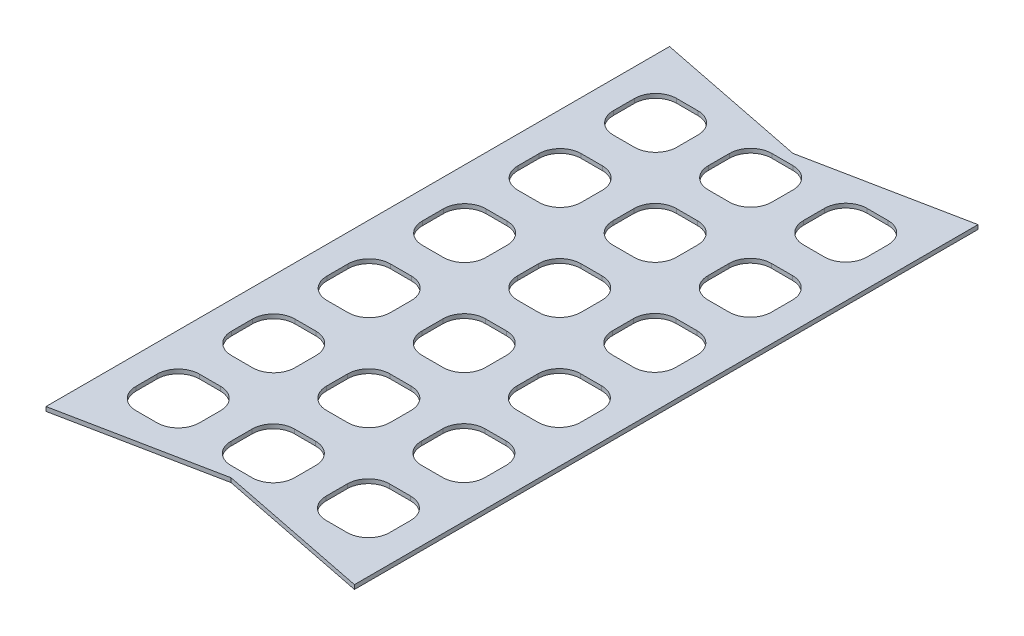
from build123d import *

# Parameters (mm, degrees)
BOSS_EXTRUDE1_DEPTH = 2
CUT_EXTRUDE1_DEPTH  = 165.642246537


with BuildPart() as part:
    # Sketch1 → Boss-Extrude1 (new body)
    with BuildSketch(Plane(origin=(0, 0, 0), x_dir=(1, 0, 0), z_dir=(0, 1, 0))):
        Polygon((-73, 147.560392195), (-73, -147.560392195), (0, -132.960392195), (73, -147.560392195), (73, 147.560392195), (0, 132.960392195), align=None)
    extrude(amount=BOSS_EXTRUDE1_DEPTH)

    # Sketch2 → Cut-Extrude1 (cut, through all)
    with BuildSketch(Plane(origin=(0, 2, 0), x_dir=(1, 0, 0), z_dir=(0, 1, 0))):
        with BuildLine():
            Line((-50, -127.960392195), (-40, -127.960392195))
            ThreePointArc((-40, -127.960392195), (-32.928932188, -125.031460006), (-30, -117.960392195))
            Line((-30, -117.960392195), (-30, -107.960392195))
            ThreePointArc((-30, -107.960392195), (-32.928932188, -100.889324383), (-40, -97.960392195))
            Line((-40, -97.960392195), (-50, -97.960392195))
            ThreePointArc((-50, -97.960392195), (-57.071067812, -100.889324383), (-60, -107.960392195))
            Line((-60, -107.960392195), (-60, -117.960392195))
            ThreePointArc((-60, -117.960392195), (-57.071067812, -125.031460006), (-50, -127.960392195))
        make_face()
        with BuildLine():
            Line((-15, -117.960392195), (-15, -107.960392195))
            ThreePointArc((-15, -107.960392195), (-12.071067812, -100.889324383), (-5, -97.960392195))
            Line((-5, -97.960392195), (5, -97.960392195))
            ThreePointArc((5, -97.960392195), (12.071067812, -100.889324383), (15, -107.960392195))
            Line((15, -107.960392195), (15, -117.960392195))
            ThreePointArc((15, -117.960392195), (12.071067812, -125.031460006), (5, -127.960392195))
            Line((5, -127.960392195), (-5, -127.960392195))
            ThreePointArc((-5, -127.960392195), (-12.071067812, -125.031460006), (-15, -117.960392195))
        make_face()
        with BuildLine():
            Line((30, -117.960392195), (30, -107.960392195))
            ThreePointArc((30, -107.960392195), (32.928932188, -100.889324383), (40, -97.960392195))
            Line((40, -97.960392195), (50, -97.960392195))
            ThreePointArc((50, -97.960392195), (57.071067812, -100.889324383), (60, -107.960392195))
            Line((60, -107.960392195), (60, -117.960392195))
            ThreePointArc((60, -117.960392195), (57.071067812, -125.031460006), (50, -127.960392195))
            Line((50, -127.960392195), (40, -127.960392195))
            ThreePointArc((40, -127.960392195), (32.928932188, -125.031460006), (30, -117.960392195))
        make_face()
        with BuildLine():
            Line((-60, -72.776235317), (-60, -62.776235317))
            ThreePointArc((-60, -62.776235317), (-57.071067812, -55.705167505), (-50, -52.776235317))
            Line((-50, -52.776235317), (-40, -52.776235317))
            ThreePointArc((-40, -52.776235317), (-32.928932188, -55.705167505), (-30, -62.776235317))
            Line((-30, -62.776235317), (-30, -72.776235317))
            ThreePointArc((-30, -72.776235317), (-32.928932188, -79.847303129), (-40, -82.776235317))
            Line((-40, -82.776235317), (-50, -82.776235317))
            ThreePointArc((-50, -82.776235317), (-57.071067812, -79.847303129), (-60, -72.776235317))
        make_face()
        with BuildLine():
            Line((-15, -72.776235317), (-15, -62.776235317))
            ThreePointArc((-15, -62.776235317), (-12.071067812, -55.705167505), (-5, -52.776235317))
            Line((-5, -52.776235317), (5, -52.776235317))
            ThreePointArc((5, -52.776235317), (12.071067812, -55.705167505), (15, -62.776235317))
            Line((15, -62.776235317), (15, -72.776235317))
            ThreePointArc((15, -72.776235317), (12.071067812, -79.847303129), (5, -82.776235317))
            Line((5, -82.776235317), (-5, -82.776235317))
            ThreePointArc((-5, -82.776235317), (-12.071067812, -79.847303129), (-15, -72.776235317))
        make_face()
        with BuildLine():
            Line((30, -72.776235317), (30, -62.776235317))
            ThreePointArc((30, -62.776235317), (32.928932188, -55.705167505), (40, -52.776235317))
            Line((40, -52.776235317), (50, -52.776235317))
            ThreePointArc((50, -52.776235317), (57.071067812, -55.705167505), (60, -62.776235317))
            Line((60, -62.776235317), (60, -72.776235317))
            ThreePointArc((60, -72.776235317), (57.071067812, -79.847303129), (50, -82.776235317))
            Line((50, -82.776235317), (40, -82.776235317))
            ThreePointArc((40, -82.776235317), (32.928932188, -79.847303129), (30, -72.776235317))
        make_face()
        with BuildLine():
            Line((-60, -27.592078439), (-60, -17.592078439))
            ThreePointArc((-60, -17.592078439), (-57.071067812, -10.521010627), (-50, -7.592078439))
            Line((-50, -7.592078439), (-40, -7.592078439))
            ThreePointArc((-40, -7.592078439), (-32.928932188, -10.521010627), (-30, -17.592078439))
            Line((-30, -17.592078439), (-30, -27.592078439))
            ThreePointArc((-30, -27.592078439), (-32.928932188, -34.663146251), (-40, -37.592078439))
            Line((-40, -37.592078439), (-50, -37.592078439))
            ThreePointArc((-50, -37.592078439), (-57.071067812, -34.663146251), (-60, -27.592078439))
        make_face()
        with BuildLine():
            Line((-15, -27.592078439), (-15, -17.592078439))
            ThreePointArc((-15, -17.592078439), (-12.071067812, -10.521010627), (-5, -7.592078439))
            Line((-5, -7.592078439), (5, -7.592078439))
            ThreePointArc((5, -7.592078439), (12.071067812, -10.521010627), (15, -17.592078439))
            Line((15, -17.592078439), (15, -27.592078439))
            ThreePointArc((15, -27.592078439), (12.071067812, -34.663146251), (5, -37.592078439))
            Line((5, -37.592078439), (-5, -37.592078439))
            ThreePointArc((-5, -37.592078439), (-12.071067812, -34.663146251), (-15, -27.592078439))
        make_face()
        with BuildLine():
            Line((30, -27.592078439), (30, -17.592078439))
            ThreePointArc((30, -17.592078439), (32.928932188, -10.521010627), (40, -7.592078439))
            Line((40, -7.592078439), (50, -7.592078439))
            ThreePointArc((50, -7.592078439), (57.071067812, -10.521010627), (60, -17.592078439))
            Line((60, -17.592078439), (60, -27.592078439))
            ThreePointArc((60, -27.592078439), (57.071067812, -34.663146251), (50, -37.592078439))
            Line((50, -37.592078439), (40, -37.592078439))
            ThreePointArc((40, -37.592078439), (32.928932188, -34.663146251), (30, -27.592078439))
        make_face()
        with BuildLine():
            Line((-60, 17.592078439), (-60, 27.592078439))
            ThreePointArc((-60, 27.592078439), (-57.071067812, 34.663146251), (-50, 37.592078439))
            Line((-50, 37.592078439), (-40, 37.592078439))
            ThreePointArc((-40, 37.592078439), (-32.928932188, 34.663146251), (-30, 27.592078439))
            Line((-30, 27.592078439), (-30, 17.592078439))
            ThreePointArc((-30, 17.592078439), (-32.928932188, 10.521010627), (-40, 7.592078439))
            Line((-40, 7.592078439), (-50, 7.592078439))
            ThreePointArc((-50, 7.592078439), (-57.071067812, 10.521010627), (-60, 17.592078439))
        make_face()
        with BuildLine():
            Line((-15, 17.592078439), (-15, 27.592078439))
            ThreePointArc((-15, 27.592078439), (-12.071067812, 34.663146251), (-5, 37.592078439))
            Line((-5, 37.592078439), (5, 37.592078439))
            ThreePointArc((5, 37.592078439), (12.071067812, 34.663146251), (15, 27.592078439))
            Line((15, 27.592078439), (15, 17.592078439))
            ThreePointArc((15, 17.592078439), (12.071067812, 10.521010627), (5, 7.592078439))
            Line((5, 7.592078439), (-5, 7.592078439))
            ThreePointArc((-5, 7.592078439), (-12.071067812, 10.521010627), (-15, 17.592078439))
        make_face()
        with BuildLine():
            Line((30, 17.592078439), (30, 27.592078439))
            ThreePointArc((30, 27.592078439), (32.928932188, 34.663146251), (40, 37.592078439))
            Line((40, 37.592078439), (50, 37.592078439))
            ThreePointArc((50, 37.592078439), (57.071067812, 34.663146251), (60, 27.592078439))
            Line((60, 27.592078439), (60, 17.592078439))
            ThreePointArc((60, 17.592078439), (57.071067812, 10.521010627), (50, 7.592078439))
            Line((50, 7.592078439), (40, 7.592078439))
            ThreePointArc((40, 7.592078439), (32.928932188, 10.521010627), (30, 17.592078439))
        make_face()
        with BuildLine():
            Line((-60, 62.776235317), (-60, 72.776235317))
            ThreePointArc((-60, 72.776235317), (-57.071067812, 79.847303129), (-50, 82.776235317))
            Line((-50, 82.776235317), (-40, 82.776235317))
            ThreePointArc((-40, 82.776235317), (-32.928932188, 79.847303129), (-30, 72.776235317))
            Line((-30, 72.776235317), (-30, 62.776235317))
            ThreePointArc((-30, 62.776235317), (-32.928932188, 55.705167505), (-40, 52.776235317))
            Line((-40, 52.776235317), (-50, 52.776235317))
            ThreePointArc((-50, 52.776235317), (-57.071067812, 55.705167505), (-60, 62.776235317))
        make_face()
        with BuildLine():
            Line((-15, 62.776235317), (-15, 72.776235317))
            ThreePointArc((-15, 72.776235317), (-12.071067812, 79.847303129), (-5, 82.776235317))
            Line((-5, 82.776235317), (5, 82.776235317))
            ThreePointArc((5, 82.776235317), (12.071067812, 79.847303129), (15, 72.776235317))
            Line((15, 72.776235317), (15, 62.776235317))
            ThreePointArc((15, 62.776235317), (12.071067812, 55.705167505), (5, 52.776235317))
            Line((5, 52.776235317), (-5, 52.776235317))
            ThreePointArc((-5, 52.776235317), (-12.071067812, 55.705167505), (-15, 62.776235317))
        make_face()
        with BuildLine():
            Line((30, 62.776235317), (30, 72.776235317))
            ThreePointArc((30, 72.776235317), (32.928932188, 79.847303129), (40, 82.776235317))
            Line((40, 82.776235317), (50, 82.776235317))
            ThreePointArc((50, 82.776235317), (57.071067812, 79.847303129), (60, 72.776235317))
            Line((60, 72.776235317), (60, 62.776235317))
            ThreePointArc((60, 62.776235317), (57.071067812, 55.705167505), (50, 52.776235317))
            Line((50, 52.776235317), (40, 52.776235317))
            ThreePointArc((40, 52.776235317), (32.928932188, 55.705167505), (30, 62.776235317))
        make_face()
        with BuildLine():
            Line((-60, 107.960392195), (-60, 117.960392195))
            ThreePointArc((-60, 117.960392195), (-57.071067812, 125.031460006), (-50, 127.960392195))
            Line((-50, 127.960392195), (-40, 127.960392195))
            ThreePointArc((-40, 127.960392195), (-32.928932188, 125.031460006), (-30, 117.960392195))
            Line((-30, 117.960392195), (-30, 107.960392195))
            ThreePointArc((-30, 107.960392195), (-32.928932188, 100.889324383), (-40, 97.960392195))
            Line((-40, 97.960392195), (-50, 97.960392195))
            ThreePointArc((-50, 97.960392195), (-57.071067812, 100.889324383), (-60, 107.960392195))
        make_face()
        with BuildLine():
            Line((-15, 107.960392195), (-15, 117.960392195))
            ThreePointArc((-15, 117.960392195), (-12.071067812, 125.031460006), (-5, 127.960392195))
            Line((-5, 127.960392195), (5, 127.960392195))
            ThreePointArc((5, 127.960392195), (12.071067812, 125.031460006), (15, 117.960392195))
            Line((15, 117.960392195), (15, 107.960392195))
            ThreePointArc((15, 107.960392195), (12.071067812, 100.889324383), (5, 97.960392195))
            Line((5, 97.960392195), (-5, 97.960392195))
            ThreePointArc((-5, 97.960392195), (-12.071067812, 100.889324383), (-15, 107.960392195))
        make_face()
        with BuildLine():
            Line((30, 107.960392195), (30, 117.960392195))
            ThreePointArc((30, 117.960392195), (32.928932188, 125.031460006), (40, 127.960392195))
            Line((40, 127.960392195), (50, 127.960392195))
            ThreePointArc((50, 127.960392195), (57.071067812, 125.031460006), (60, 117.960392195))
            Line((60, 117.960392195), (60, 107.960392195))
            ThreePointArc((60, 107.960392195), (57.071067812, 100.889324383), (50, 97.960392195))
            Line((50, 97.960392195), (40, 97.960392195))
            ThreePointArc((40, 97.960392195), (32.928932188, 100.889324383), (30, 107.960392195))
        make_face()
    extrude(amount=-CUT_EXTRUDE1_DEPTH, mode=Mode.SUBTRACT)


solid = part.part
